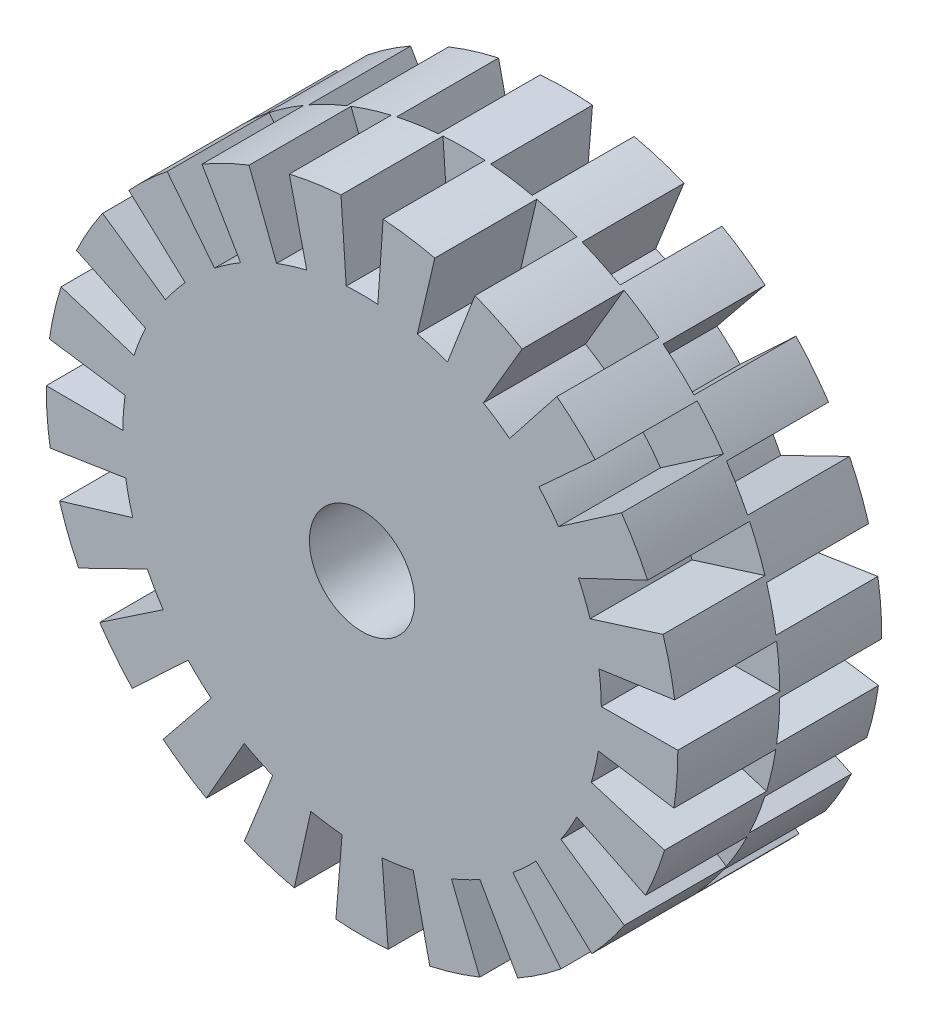
from build123d import *

# Parameters (mm, degrees)
ESQUISSE1_R             = 12
ESQUISSE1_R_2           = 2
BOSS_EXTRU_1_DEPTH      = 7.75
ENL_V_MAT_EXTRU_1_DEPTH = 3.875
ENL_V_MAT_EXTRU_2_DEPTH = 3.875


with BuildPart() as part:
    # Esquisse1 → Boss.-Extru.1 (new body)
    with BuildSketch(Plane.XY):
        Circle(ESQUISSE1_R)
        Circle(ESQUISSE1_R_2, mode=Mode.SUBTRACT)
    extrude(amount=BOSS_EXTRU_1_DEPTH)

    # Esquisse2 → Enlèv. mat.-Extru.1 (cut)
    with BuildSketch(Plane.XY.offset(7.75)):
        with BuildLine():
            Line((-0.8, 11.973303638), (-0.6, 9.073303638))
            ThreePointArc((-0.6, 9.073303638), (0, 9.093120416), (0.6, 9.073303638))
            Line((0.6, 9.073303638), (0.8, 11.973303638))
            Line((0.8, 11.973303638), (1.216363407, 18.010573039))
            Line((1.216363407, 18.010573039), (-1.216363407, 18.010573039))
            Line((-1.216363407, 18.010573039), (-0.8, 11.973303638))
        make_face()
        with BuildLine():
            Line((2.764734957, 11.677167491), (2.101059513, 8.847055319))
            ThreePointArc((2.101059513, 8.847055319), (2.680244294, 8.689138589), (3.24774688, 8.49334911))
            Line((3.24774688, 8.49334911), (4.293651447, 11.205559212))
            Line((4.293651447, 11.205559212), (6.471033391, 16.851884405))
            Line((6.471033391, 16.851884405), (4.146385804, 17.568943221))
            Line((4.146385804, 17.568943221), (2.764734957, 11.677167491))
        make_face()
        with BuildLine():
            Line((6.083811081, 10.343463769), (4.615430667, 7.834707311))
            ThreePointArc((4.615430667, 7.834707311), (5.122337121, 7.513088667), (5.606917197, 7.158723242))
            Line((5.606917197, 7.158723242), (7.40579312, 9.442151676))
            Line((7.40579312, 9.442151676), (11.150723661, 14.195831888))
            Line((11.150723661, 14.195831888), (9.14071044, 15.566235698))
            Line((9.14071044, 15.566235698), (6.083811081, 10.343463769))
        make_face()
        with BuildLine():
            Line((8.862313892, 8.090697899), (6.719700553, 6.126211177))
            ThreePointArc((6.719700553, 6.126211177), (7.109287815, 5.669467847), (7.467888315, 5.188013398))
            Line((7.467888315, 5.188013398), (9.859897575, 6.839767527))
            Line((9.859897575, 6.839767527), (14.839623199, 10.27841741))
            Line((14.839623199, 10.27841741), (13.32284284, 12.180399821))
            Line((13.32284284, 12.180399821), (8.862313892, 8.090697899))
        make_face()
        with BuildLine():
            Line((10.853361221, 5.119038015), (8.226895555, 3.873374295))
            ThreePointArc((8.226895555, 3.873374295), (8.464547089, 3.322089928), (8.665304784, 2.756325796))
            Line((8.665304784, 2.756325796), (11.43790686, 3.629640017))
            Line((11.43790686, 3.629640017), (17.209957093, 5.447720439))
            Line((17.209957093, 5.447720439), (16.321182187, 7.712281968))
            Line((16.321182187, 7.712281968), (10.853361221, 5.119038015))
        make_face()
        with BuildLine():
            Line((11.880039777, 1.692529139), (9.003094784, 1.276371108))
            ThreePointArc((9.003094784, 1.276371108), (9.067694207, 0.67952974), (9.092770897, 0.079726552))
            Line((9.092770897, 0.079726552), (11.999607927, 0.097003064))
            Line((11.999607927, 0.097003064), (18.051110775, 0.132969601))
            Line((18.051110775, 0.132969601), (17.869312873, 2.558894017))
            Line((17.869312873, 2.558894017), (11.880039777, 1.692529139))
        make_face()
        with BuildLine():
            Line((11.851124665, -1.884368378), (8.979329532, -1.434043252))
            ThreePointArc((8.979329532, -1.434043252), (8.865136902, -2.023409648), (8.712304412, -2.603956747))
            Line((8.712304412, -2.603956747), (11.49509117, -3.444253038))
            Line((11.49509117, -3.444253038), (17.288344049, -5.193596171))
            Line((17.288344049, -5.193596171), (17.829676692, -2.821862897))
            Line((17.829676692, -2.821862897), (11.851124665, -1.884368378))
        make_face()
        with BuildLine():
            Line((10.769185117, -5.293831496), (8.157711446, -4.017036577))
            ThreePointArc((8.157711446, -4.017036577), (7.87487328, -4.546560208), (7.557711446, -5.056267061))
            Line((7.557711446, -5.056267061), (9.969185117, -6.679472142))
            Line((9.969185117, -6.679472142), (14.989432085, -10.05868813))
            Line((14.989432085, -10.05868813), (16.205795492, -7.951884909))
            Line((16.205795492, -7.951884909), (10.769185117, -5.293831496))
        make_face()
        with BuildLine():
            Line((8.730356213, -8.232914453), (6.611244899, -6.243098573))
            ThreePointArc((6.611244899, -6.243098573), (6.184892608, -6.665728942), (5.731582653, -7.059305858))
            Line((5.731582653, -7.059305858), (7.557473218, -9.321190834))
            Line((7.557473218, -9.321190834), (11.358643301, -14.030021508))
            Line((11.358643301, -14.030021508), (13.141958245, -12.37534705))
            Line((13.141958245, -12.37534705), (8.730356213, -8.232914453))
        make_face()
        with BuildLine():
            Line((5.915796846, -10.440466832), (4.477340229, -7.914433863))
            ThreePointArc((4.477340229, -7.914433863), (3.945357086, -8.192618407), (3.396177588, -8.43509435))
            Line((3.396177588, -8.43509435), (4.474246658, -11.134680815))
            Line((4.474246658, -11.134680815), (6.718589212, -16.754725905))
            Line((6.718589212, -16.754725905), (8.910400336, -15.699205298))
            Line((8.910400336, -15.699205298), (5.915796846, -10.440466832))
        make_face()
        with BuildLine():
            Line((2.575592969, -11.720337916), (1.945604232, -8.882536973))
            ThreePointArc((1.945604232, -8.882536973), (1.355259273, -8.991557774), (0.75900724, -9.061387692))
            Line((0.75900724, -9.061387692), (0.993463647, -11.958805542))
            Line((0.993463647, -11.958805542), (1.481558988, -17.990699378))
            Line((1.481558988, -17.990699378), (3.887114254, -17.62812026))
            Line((3.887114254, -17.62812026), (2.575592969, -11.720337916))
        make_face()
        with BuildLine():
            Line((-0.993463647, -11.958805542), (-0.75900724, -9.061387692))
            ThreePointArc((-0.75900724, -9.061387692), (-1.355259273, -8.991557774), (-1.945604232, -8.882536973))
            Line((-1.945604232, -8.882536973), (-2.575592969, -11.720337916))
            Line((-2.575592969, -11.720337916), (-3.887114254, -17.62812026))
            Line((-3.887114254, -17.62812026), (-1.481558988, -17.990699378))
            Line((-1.481558988, -17.990699378), (-0.993463647, -11.958805542))
        make_face()
        with BuildLine():
            Line((-4.474246658, -11.134680815), (-3.396177588, -8.43509435))
            ThreePointArc((-3.396177588, -8.43509435), (-3.945357086, -8.192618407), (-4.477340229, -7.914433863))
            Line((-4.477340229, -7.914433863), (-5.915796846, -10.440466832))
            Line((-5.915796846, -10.440466832), (-8.910400336, -15.699205298))
            Line((-8.910400336, -15.699205298), (-6.718589212, -16.754725905))
            Line((-6.718589212, -16.754725905), (-4.474246658, -11.134680815))
        make_face()
        with BuildLine():
            Line((-7.557473218, -9.321190834), (-5.731582653, -7.059305858))
            ThreePointArc((-5.731582653, -7.059305858), (-6.184892608, -6.665728942), (-6.611244899, -6.243098573))
            Line((-6.611244899, -6.243098573), (-8.730356213, -8.232914453))
            Line((-8.730356213, -8.232914453), (-13.141958245, -12.37534705))
            Line((-13.141958245, -12.37534705), (-11.358643301, -14.030021508))
            Line((-11.358643301, -14.030021508), (-7.557473218, -9.321190834))
        make_face()
        with BuildLine():
            Line((-9.969185117, -6.679472142), (-7.557711446, -5.056267061))
            ThreePointArc((-7.557711446, -5.056267061), (-7.87487328, -4.546560208), (-8.157711446, -4.017036577))
            Line((-8.157711446, -4.017036577), (-10.769185117, -5.293831496))
            Line((-10.769185117, -5.293831496), (-16.205795492, -7.951884909))
            Line((-16.205795492, -7.951884909), (-14.989432085, -10.05868813))
            Line((-14.989432085, -10.05868813), (-9.969185117, -6.679472142))
        make_face()
        with BuildLine():
            Line((-11.49509117, -3.444253038), (-8.712304412, -2.603956747))
            ThreePointArc((-8.712304412, -2.603956747), (-8.865136902, -2.023409648), (-8.979329532, -1.434043252))
            Line((-8.979329532, -1.434043252), (-11.851124665, -1.884368378))
            Line((-11.851124665, -1.884368378), (-17.829676692, -2.821862897))
            Line((-17.829676692, -2.821862897), (-17.288344049, -5.193596171))
            Line((-17.288344049, -5.193596171), (-11.49509117, -3.444253038))
        make_face()
        with BuildLine():
            Line((-11.999607927, 0.097003064), (-9.092770897, 0.079726552))
            ThreePointArc((-9.092770897, 0.079726552), (-9.067694207, 0.67952974), (-9.003094784, 1.276371108))
            Line((-9.003094784, 1.276371108), (-11.880039777, 1.692529139))
            Line((-11.880039777, 1.692529139), (-17.869312873, 2.558894017))
            Line((-17.869312873, 2.558894017), (-18.051110775, 0.132969601))
            Line((-18.051110775, 0.132969601), (-11.999607927, 0.097003064))
        make_face()
        with BuildLine():
            Line((-11.43790686, 3.629640017), (-8.665304784, 2.756325796))
            ThreePointArc((-8.665304784, 2.756325796), (-8.464547089, 3.322089928), (-8.226895555, 3.873374295))
            Line((-8.226895555, 3.873374295), (-10.853361221, 5.119038015))
            Line((-10.853361221, 5.119038015), (-16.321182187, 7.712281968))
            Line((-16.321182187, 7.712281968), (-17.209957093, 5.447720439))
            Line((-17.209957093, 5.447720439), (-11.43790686, 3.629640017))
        make_face()
        with BuildLine():
            Line((-9.859897575, 6.839767527), (-7.467888315, 5.188013398))
            ThreePointArc((-7.467888315, 5.188013398), (-7.109287815, 5.669467847), (-6.719700553, 6.126211177))
            Line((-6.719700553, 6.126211177), (-8.862313892, 8.090697899))
            Line((-8.862313892, 8.090697899), (-13.32284284, 12.180399821))
            Line((-13.32284284, 12.180399821), (-14.839623199, 10.27841741))
            Line((-14.839623199, 10.27841741), (-9.859897575, 6.839767527))
        make_face()
        with BuildLine():
            Line((-7.40579312, 9.442151676), (-5.606917197, 7.158723242))
            ThreePointArc((-5.606917197, 7.158723242), (-5.122337121, 7.513088667), (-4.615430667, 7.834707311))
            Line((-4.615430667, 7.834707311), (-6.083811081, 10.343463769))
            Line((-6.083811081, 10.343463769), (-9.14071044, 15.566235698))
            Line((-9.14071044, 15.566235698), (-11.150723661, 14.195831888))
            Line((-11.150723661, 14.195831888), (-7.40579312, 9.442151676))
        make_face()
        with BuildLine():
            Line((-4.293651447, 11.205559212), (-3.24774688, 8.49334911))
            ThreePointArc((-3.24774688, 8.49334911), (-2.680244294, 8.689138589), (-2.101059513, 8.847055319))
            Line((-2.101059513, 8.847055319), (-2.764734957, 11.677167491))
            Line((-2.764734957, 11.677167491), (-4.146385804, 17.568943221))
            Line((-4.146385804, 17.568943221), (-6.471033391, 16.851884405))
            Line((-6.471033391, 16.851884405), (-4.293651447, 11.205559212))
        make_face()
    extrude(amount=-ENL_V_MAT_EXTRU_1_DEPTH, mode=Mode.SUBTRACT)

    # Esquisse3 → Enlèv. mat.-Extru.2 (cut)
    with BuildSketch(Plane(origin=(0, 0, 0), x_dir=(-1, 0, 0), z_dir=(0, 0, -1))):
        with BuildLine():
            Line((1.150666399, 14.119005081), (0.747367591, 9.060034763))
            ThreePointArc((0.747367591, 9.060034763), (1.343706962, 8.990953221), (1.934186627, 8.88266347))
            Line((1.934186627, 8.88266347), (3.027609835, 13.838494005))
            Line((3.027609835, 13.838494005), (1.150666399, 14.119005081))
        make_face()
        with BuildLine():
            Line((5.261195324, 13.152572425), (3.384656273, 8.437232375))
            ThreePointArc((3.384656273, 8.437232375), (3.934139817, 8.195445817), (4.466467162, 7.917920138))
            Line((4.466467162, 7.917920138), (6.972069338, 12.331284879))
            Line((6.972069338, 12.331284879), (5.261195324, 13.152572425))
        make_face()
        with BuildLine():
            Line((8.904243957, 11.01747599), (5.721203391, 7.064744863))
            ThreePointArc((5.721203391, 7.064744863), (6.175007084, 6.671737086), (6.60188249, 6.249634855))
            Line((6.60188249, 6.249634855), (10.297029885, 9.728386977))
            Line((10.297029885, 9.728386977), (8.904243957, 11.01747599))
        make_face()
        with BuildLine():
            Line((11.756111438, 7.903428464), (7.549396481, 5.064523768))
            ThreePointArc((7.549396481, 5.064523768), (7.867197873, 4.555215236), (8.150691586, 4.026042089))
            Line((8.150691586, 4.026042089), (12.707054139, 6.2610792))
            Line((12.707054139, 6.2610792), (11.756111438, 7.903428464))
        make_face()
        with BuildLine():
            Line((13.563396827, 4.087126635), (8.706792564, 2.61429751))
            ThreePointArc((8.706792564, 2.61429751), (8.860353607, 2.033942523), (8.975275966, 1.444717815))
            Line((8.975275966, 1.444717815), (13.988000868, 2.237447059))
            Line((13.988000868, 2.237447059), (13.563396827, 4.087126635))
        make_face()
        with BuildLine():
            Line((14.165514887, -0.092334331), (9.090551919, -0.068220554))
            ThreePointArc((9.090551919, -0.068220554), (9.06622804, -0.668054909), (9.002367689, -1.264975976))
            Line((9.002367689, -1.264975976), (14.026052335, -1.984992071))
            Line((14.026052335, -1.984992071), (14.165514887, -0.092334331))
        make_face()
        with BuildLine():
            Line((13.508964784, -4.263590987), (8.666575842, -2.744676922))
            ThreePointArc((8.666575842, -2.744676922), (8.466528325, -3.310692731), (8.229559537, -3.862271101))
            Line((8.229559537, -3.862271101), (12.8178275, -6.031055945))
            Line((12.8178275, -6.031055945), (13.508964784, -4.263590987))
        make_face()
        with BuildLine():
            Line((11.652083876, -8.056008873), (7.472536469, -5.177256701))
            ThreePointArc((7.472536469, -5.177256701), (7.114540413, -5.659160975), (6.725518905, -6.11638649))
            Line((6.725518905, -6.11638649), (10.470682441, -9.541234032))
            Line((10.470682441, -9.541234032), (11.652083876, -8.056008873))
        make_face()
        with BuildLine():
            Line((8.759864183, -11.132615018), (5.614529438, -7.149814503))
            ThreePointArc((5.614529438, -7.149814503), (5.130394364, -7.504787932), (4.623886404, -7.827034097))
            Line((4.623886404, -7.827034097), (7.193171297, -12.203631604))
            Line((7.193171297, -12.203631604), (8.759864183, -11.132615018))
        make_face()
        with BuildLine():
            Line((5.089292114, -13.220039463), (3.257646827, -8.487079909))
            ThreePointArc((3.257646827, -8.487079909), (2.690390262, -8.683581546), (2.111401304, -8.842215376))
            Line((2.111401304, -8.842215376), (3.276515317, -13.781682953))
            Line((3.276515317, -13.781682953), (5.089292114, -13.220039463))
        make_face()
        with BuildLine():
            Line((0.966514107, -14.132805387), (0.611308, -9.07023102))
            ThreePointArc((0.611308, -9.07023102), (0.011333178, -9.090800833), (-0.588691067, -9.071727016))
            Line((-0.588691067, -9.071727016), (-0.931273427, -14.135171291))
            Line((-0.931273427, -14.135171291), (0.966514107, -14.132805387))
        make_face()
        with BuildLine():
            Line((-3.242142919, -13.789809532), (-2.089348225, -8.847452301))
            ThreePointArc((-2.089348225, -8.847452301), (-2.668730909, -8.690262572), (-3.236475654, -8.4951759))
            Line((-3.236475654, -8.4951759), (-5.056314441, -13.23268763))
            Line((-5.056314441, -13.23268763), (-3.242142919, -13.789809532))
        make_face()
        with BuildLine():
            Line((-7.16272132, -12.221528584), (-4.604356692, -7.838538619))
            ThreePointArc((-4.604356692, -7.838538619), (-5.111666542, -7.517556344), (-5.596685175, -7.163791125))
            Line((-5.596685175, -7.163791125), (-8.732079728, -11.154421601))
            Line((-8.732079728, -11.154421601), (-7.16272132, -12.221528584))
        make_face()
        with BuildLine():
            Line((-10.446860498, -9.567311188), (-6.710247861, -6.133136382))
            ThreePointArc((-6.710247861, -6.133136382), (-7.100408172, -5.676882245), (-7.459604658, -5.19587207))
            Line((-7.459604658, -5.19587207), (-11.63196141, -8.085036263))
            Line((-11.63196141, -8.085036263), (-10.446860498, -9.567311188))
        make_face()
        with BuildLine():
            Line((-12.802750276, -6.062996207), (-8.21990406, -3.882778062))
            ThreePointArc((-8.21990406, -3.882778062), (-8.458247375, -3.331792246), (-8.659705532, -2.76627698))
            Line((-8.659705532, -2.76627698), (-13.498292275, -4.297259973))
            Line((-13.498292275, -4.297259973), (-12.802750276, -6.062996207))
        make_face()
        with BuildLine():
            Line((-14.021059507, -2.019957407), (-8.999185711, -1.287417872))
            ThreePointArc((-8.999185711, -1.287417872), (-9.064534181, -0.690657885), (-9.090353566, -0.090886041))
            Line((-9.090353566, -0.090886041), (-14.165240636, -0.127653276))
            Line((-14.165240636, -0.127653276), (-14.021059507, -2.019957407))
        make_face()
        with BuildLine():
            Line((-13.993536071, 2.202563473), (-8.978850219, 1.422335045))
            ThreePointArc((-8.978850219, 1.422335045), (-8.865397346, 2.011844461), (-8.713283794, 2.592580521))
            Line((-8.713283794, 2.592580521), (-13.573545203, 4.053295975))
            Line((-13.573545203, 4.053295975), (-13.993536071, 2.202563473))
        make_face()
        with BuildLine():
            Line((-12.722625546, 6.229376923), (-8.160704482, 4.005707252))
            ThreePointArc((-8.160704482, 4.005707252), (-7.878531051, 4.535585597), (-7.562000519, 5.045684927))
            Line((-7.562000519, 5.045684927), (-11.775780711, 7.874092091))
            Line((-11.775780711, 7.874092091), (-12.722625546, 6.229376923))
        make_face()
        with BuildLine():
            Line((-10.321253908, 9.702682897), (-6.617444339, 6.233154791))
            ThreePointArc((-6.617444339, 6.233154791), (-6.191622698, 6.656320049), (-5.738800312, 7.050458085))
            Line((-5.738800312, 7.050458085), (-8.931686427, 10.99524057))
            Line((-8.931686427, 10.99524057), (-10.321253908, 9.702682897))
        make_face()
        with BuildLine():
            Line((-7.002793567, 12.313862915), (-4.486195227, 7.906759173))
            ThreePointArc((-4.486195227, 7.906759173), (-3.954561497, 8.185611254), (-3.405682514, 8.428767101))
            Line((-3.405682514, 8.428767101), (-5.293972607, 13.139413673))
            Line((-5.293972607, 13.139413673), (-7.002793567, 12.313862915))
        make_face()
        with BuildLine():
            Line((-3.062104286, 13.830902175), (-1.956327981, 8.877813304))
            ThreePointArc((-1.956327981, 8.877813304), (-1.366120153, 8.987574976), (-0.769954878, 9.058143172))
            Line((-0.769954878, 9.058143172), (-1.18586609, 14.116092209))
            Line((-1.18586609, 14.116092209), (-3.062104286, 13.830902175))
        make_face()
    extrude(amount=-ENL_V_MAT_EXTRU_2_DEPTH, mode=Mode.SUBTRACT)


solid = part.part
